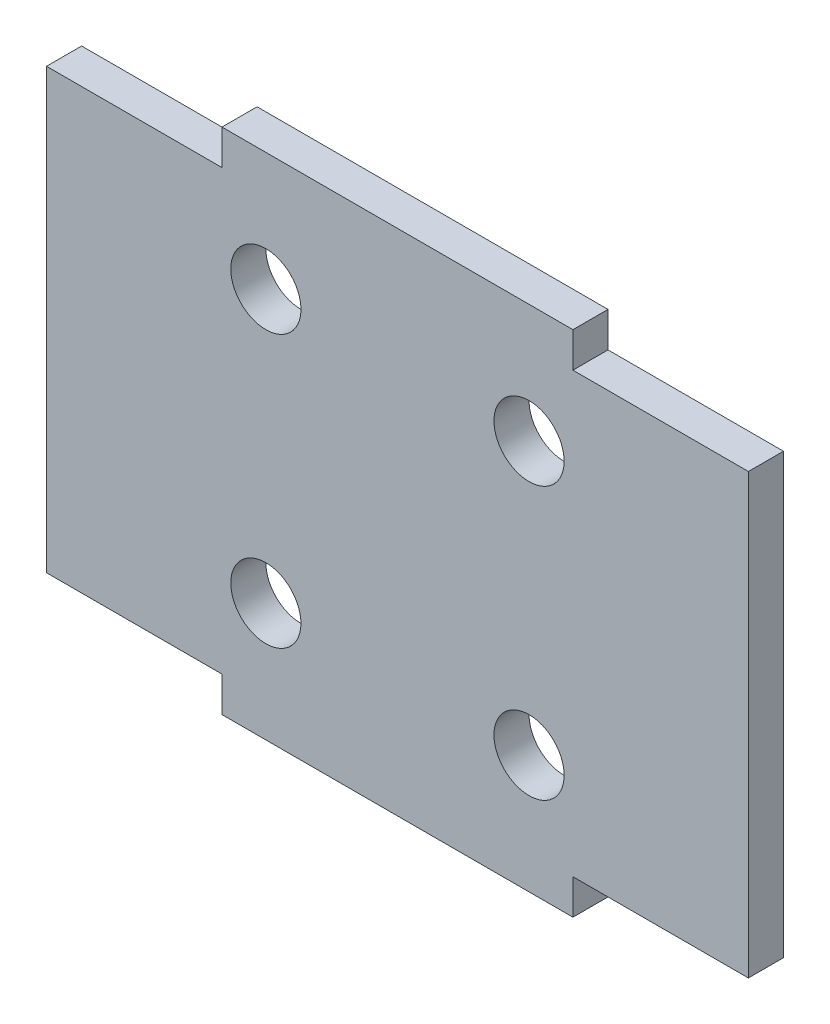
from build123d import *

# Parameters (mm, degrees)
SKETCH1_R           = 4
BOSS_EXTRUDE1_DEPTH = 4


with BuildPart() as part:
    # Sketch1 → Boss-Extrude1 (new body)
    with BuildSketch(Plane.XY):
        Polygon((-20, 29), (20, 29), (20, 25), (40, 25), (40, -25), (20, -25), (20, -29), (-20, -29), (-20, -25), (-40, -25), (-40, 25), (-20, 25), align=None)
        with Locations((15, 15.5)):
            Circle(SKETCH1_R, mode=Mode.SUBTRACT)
        with Locations(Location((-15, 15.5, 0), (0, 0, 180))):
            Circle(SKETCH1_R, mode=Mode.SUBTRACT)
        with Locations((-15, -15.5)):
            Circle(SKETCH1_R, mode=Mode.SUBTRACT)
        with Locations(Location((15, -15.5, 0), (0, 0, 180))):
            Circle(SKETCH1_R, mode=Mode.SUBTRACT)
    extrude(amount=BOSS_EXTRUDE1_DEPTH)


solid = part.part
